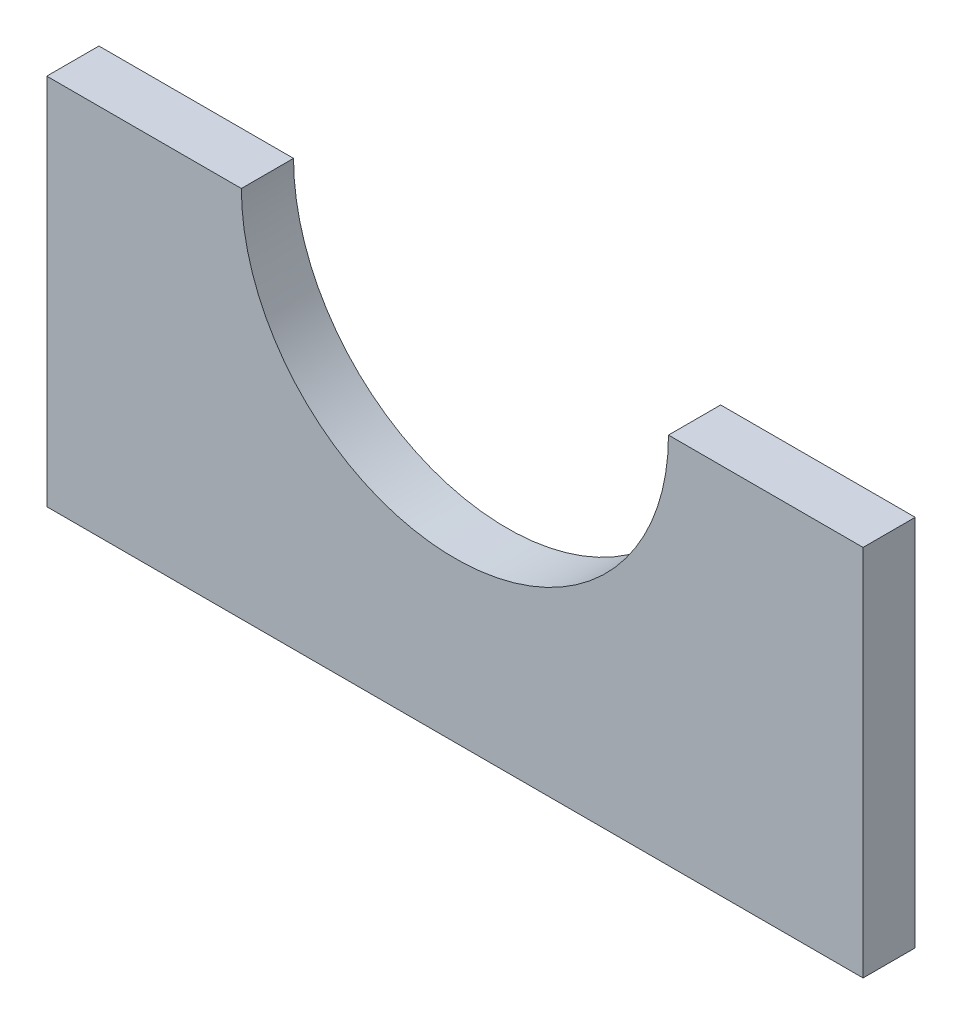
from build123d import *

# Parameters (mm, degrees)
SKETCH1_W                = 39.69
SKETCH1_H                = 3.175
BOSS_EXTRUDE2_DEPTH      = 12.7
CUT_EXTRUDE1_DEPTH       = 12.7
BOSS_EXTRUDE3_DEPTH      = 1.5875
BOSS_EXTRUDE3_DEPTH_BACK = 1.5875
SKETCH5_W                = 5
SKETCH5_H                = 12.7
SKETCH6_W                = 49.69
SKETCH6_H                = 5
BOSS_EXTRUDE4_DEPTH      = 3.175
CUT_EXTRUDE2_DEPTH       = 3.175
SKETCH8_W                = 49.69
SKETCH8_H                = 5
BOSS_EXTRUDE5_DEPTH      = 3.175


with BuildPart() as part:
    # Sketch1 → Boss-Extrude2 (new body)
    with BuildSketch(Plane(origin=(0, 0, 0), x_dir=(1, 0, 0), z_dir=(0, 1, 0))):
        Rectangle(SKETCH1_W, SKETCH1_H)
    extrude(amount=BOSS_EXTRUDE2_DEPTH)

    # Sketch3 → Cut-Extrude1 (cut)
    with BuildSketch(Plane.XY.offset(1.5875)):
        with BuildLine():
            Line((-11, 12.7), (11, 12.7))
            ThreePointArc((11, 12.7), (0, 1.7), (-11, 12.7))
        make_face()
    extrude(amount=-CUT_EXTRUDE1_DEPTH, mode=Mode.SUBTRACT)

    # Sketch5 → Boss-Extrude3 (add, two sides: drawn at the far end of the back side and taken through both)
    with BuildSketch(Plane.XY.offset(-BOSS_EXTRUDE3_DEPTH_BACK)):
        with Locations((22.345, 6.35)):
            Rectangle(SKETCH5_W, SKETCH5_H)
        with Locations((-22.345, 6.35)):
            Rectangle(SKETCH5_W, SKETCH5_H)
    extrude(amount=BOSS_EXTRUDE3_DEPTH + BOSS_EXTRUDE3_DEPTH_BACK)

    # Sketch6 → Boss-Extrude4 (add)
    with BuildSketch(Plane.XY.offset(1.5875)):
        with Locations((0, -2.5)):
            Rectangle(SKETCH6_W, SKETCH6_H)
    extrude(amount=-BOSS_EXTRUDE4_DEPTH)

    # Sketch7 → Cut-Extrude2 (cut)
    with BuildSketch(Plane.XY.offset(1.5875)):
        with BuildLine():
            ThreePointArc((11, 12.7), (0, 1.7), (-11, 12.7))
            Line((-11, 12.7), (-13, 12.7))
            ThreePointArc((-13, 12.7), (0, -0.3), (13, 12.7))
            Line((13, 12.7), (11, 12.7))
        make_face()
    extrude(amount=-CUT_EXTRUDE2_DEPTH, mode=Mode.SUBTRACT)

    # Sketch8 → Boss-Extrude5 (add)
    with BuildSketch(Plane.XY.offset(1.5875)):
        with Locations((0, -7.5)):
            Rectangle(SKETCH8_W, SKETCH8_H)
    extrude(amount=-BOSS_EXTRUDE5_DEPTH)


solid = part.part
